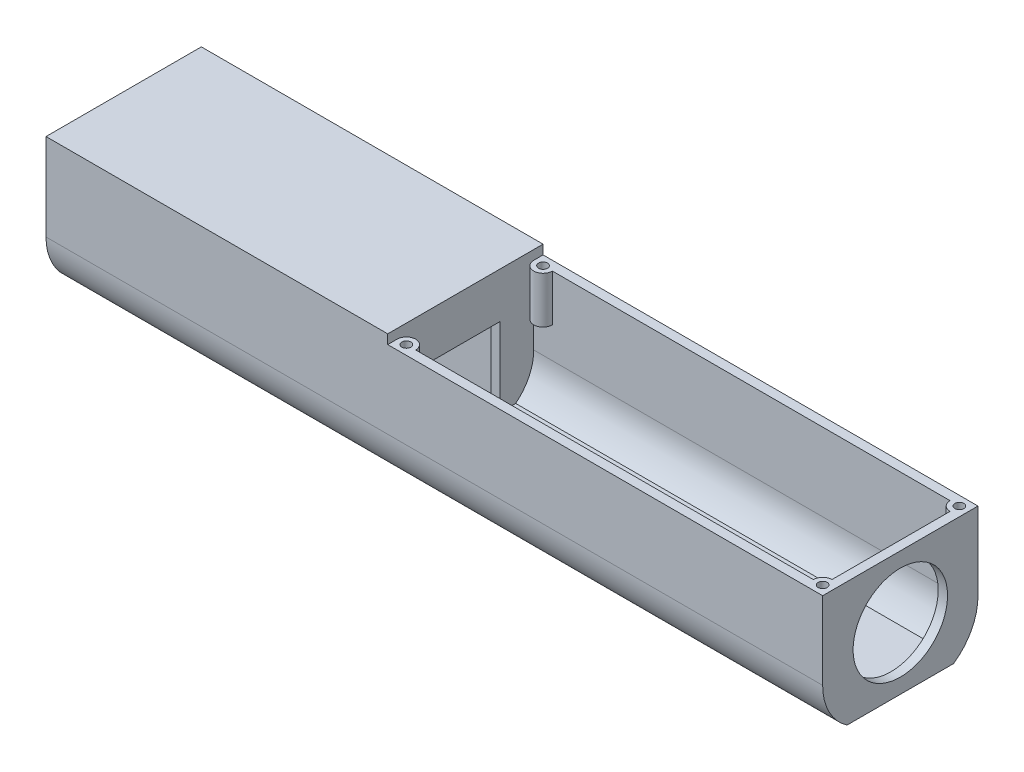
from build123d import *

# Parameters (mm, degrees)
SKETCH1_W           = 50
SKETCH1_H           = 25
BOSS_EXTRUDE1_DEPTH = 250
SHELL1_T            = -3
SKETCH2_W           = 50
SKETCH2_H           = 25
BOSS_EXTRUDE2_DEPTH = 110
SKETCH3_W           = 28.35
SKETCH3_H           = 31.35
CUT_EXTRUDE1_DEPTH  = 107
SKETCH4_W           = 28.35
SKETCH4_H           = 5
CUT_EXTRUDE2_DEPTH  = 3
SKETCH5_R           = 1.45
CUT_EXTRUDE3_DEPTH  = 10
SKETCH6_W           = 8
SKETCH6_H           = 2
CUT_EXTRUDE4_DEPTH  = 10
SKETCH7_W           = 22.35
SKETCH7_H           = 23.35
CUT_EXTRUDE5_DEPTH  = 10
SKETCH9_W           = 110
SKETCH9_H           = 50
BOSS_EXTRUDE3_DEPTH = 3
SKETCH10_R          = 15.2
CUT_EXTRUDE6_DEPTH  = 3
SKETCH11_R          = 3
BOSS_EXTRUDE4_DEPTH = 15
SKETCH12_R          = 1.45
CUT_EXTRUDE7_DEPTH  = 10
SKETCH13_R          = 1.6
CUT_EXTRUDE8_DEPTH  = 10
CHAMFER1_SIZE       = 1


with BuildPart() as part:
    # Sketch1 → Boss-Extrude1 (new body)
    with BuildSketch(Plane(origin=(0, 0, 0), x_dir=(0, 0, -1), z_dir=(1, 0, 0))):
        with BuildLine():
            ThreePointArc((23.062381853, -6.238185255), (20.988557625, -14.697361116), (15.237381853, -21.238185255))
            Line((15.237381853, -21.238185255), (-19.112618147, -21.238185255))
            ThreePointArc((-19.112618147, -21.238185255), (-24.86379392, -14.697361116), (-26.937618147, -6.238185255))
            Line((-26.937618147, -6.238185255), (23.062381853, -6.238185255))
        make_face()
        with Locations((-1.937618147, 6.261814745)):
            Rectangle(SKETCH1_W, SKETCH1_H)
    extrude(amount=BOSS_EXTRUDE1_DEPTH)

    # Shell1
    shell1_openings = [part.faces().sort_by_distance(p)[0] for p in [
        (125, 18.761814745, 1.937618147),
    ]]
    offset(amount=SHELL1_T, openings=shell1_openings, kind=Kind.INTERSECTION)

    # Sketch2 → Boss-Extrude2 (add)
    with BuildSketch(Plane.ZY):
        with Locations((1.937618147, 6.261814745)):
            Rectangle(SKETCH2_W, SKETCH2_H)
        with BuildLine():
            Line((-23.062381853, -6.238185255), (26.937618147, -6.238185255))
            ThreePointArc((26.937618147, -6.238185255), (24.86379392, -14.697361116), (19.112618147, -21.238185255))
            Line((19.112618147, -21.238185255), (-15.237381853, -21.238185255))
            ThreePointArc((-15.237381853, -21.238185255), (-20.988557625, -14.697361116), (-23.062381853, -6.238185255))
        make_face()
    extrude(amount=-BOSS_EXTRUDE2_DEPTH)

    # Sketch3 → Cut-Extrude1 (cut)
    with BuildSketch(Plane.ZY):
        with Locations((1.937618147, -5.563185255)):
            Rectangle(SKETCH3_W, SKETCH3_H)
    extrude(amount=-CUT_EXTRUDE1_DEPTH, mode=Mode.SUBTRACT)

    # Sketch4 → Cut-Extrude2 (cut)
    with BuildSketch(Plane.ZY):
        with Locations((1.937618147, 12.611814745)):
            Rectangle(SKETCH4_W, SKETCH4_H)
    extrude(amount=-CUT_EXTRUDE2_DEPTH, mode=Mode.SUBTRACT)

    # Sketch5 → Cut-Extrude3 (cut)
    with BuildSketch(Plane.ZY.offset(-3)):
        with Locations((-7.062381853, 12.611814745)):
            Circle(SKETCH5_R)
        with Locations((10.937618147, 12.611814745)):
            Circle(SKETCH5_R)
    extrude(amount=-CUT_EXTRUDE3_DEPTH, mode=Mode.SUBTRACT)

    # Sketch6 → Cut-Extrude4 (cut)
    with BuildSketch(Plane.ZY.offset(-107)):
        with Locations((1.937618147, -19.238185255)):
            Rectangle(SKETCH6_W, SKETCH6_H)
    extrude(amount=-CUT_EXTRUDE4_DEPTH, mode=Mode.SUBTRACT)

    # Sketch7 → Cut-Extrude5 (cut)
    with BuildSketch(Plane.ZY.offset(-107)):
        with Locations((1.937618147, -4.563185255)):
            Rectangle(SKETCH7_W, SKETCH7_H)
    extrude(amount=-CUT_EXTRUDE5_DEPTH, mode=Mode.SUBTRACT)

    # Sketch9 → Boss-Extrude3 (add)
    with BuildSketch(Plane(origin=(0, 18.761814745, 0), x_dir=(1, 0, 0), z_dir=(0, 1, 0))):
        with Locations((55, -1.937618147)):
            Rectangle(SKETCH9_W, SKETCH9_H)
    extrude(amount=BOSS_EXTRUDE3_DEPTH)

    # Sketch10 → Cut-Extrude6 (cut)
    with BuildSketch(Plane(origin=(250, 0, 0), x_dir=(0, 0, -1), z_dir=(1, 0, 0))):
        with Locations((-1.937618147, -1.238185255)):
            Circle(SKETCH10_R)
    extrude(amount=-CUT_EXTRUDE6_DEPTH, mode=Mode.SUBTRACT)

    # Sketch11 → Boss-Extrude4 (add)
    with BuildSketch(Plane(origin=(0, 18.761814745, 0), x_dir=(1, 0, 0), z_dir=(0, 1, 0))):
        with Locations((247, -23.937618147)):
            Circle(SKETCH11_R)
        with Locations((247, 20.062381853)):
            Circle(SKETCH11_R)
        with Locations((113, 20.062381853)):
            Circle(SKETCH11_R)
        with Locations((113, -23.937618147)):
            Circle(SKETCH11_R)
    extrude(amount=-BOSS_EXTRUDE4_DEPTH)

    # Sketch12 → Cut-Extrude7 (cut)
    with BuildSketch(Plane(origin=(0, 18.761814745, 0), x_dir=(1, 0, 0), z_dir=(0, 1, 0))):
        with Locations(Location((113, 20.062381853, 0), (0, 0, 270))):
            Circle(SKETCH12_R)
        with Locations(Location((113, -23.937618147, 0), (0, 0, 270))):
            Circle(SKETCH12_R)
        with Locations(Location((247, -23.937618147, 0), (0, 0, 270))):
            Circle(SKETCH12_R)
        with Locations(Location((247, 20.062381853, 0), (0, 0, 270))):
            Circle(SKETCH12_R)
    extrude(amount=-CUT_EXTRUDE7_DEPTH, mode=Mode.SUBTRACT)

    # Sketch13 → Cut-Extrude8 (cut)
    with BuildSketch(Plane(origin=(0, -18.238185255, 0), x_dir=(1, 0, 0), z_dir=(0, 1, 0))):
        with Locations(Location((150, 10.063881853, 0), (0, 0, 270))):
            Circle(SKETCH13_R)
        with Locations(Location((150, -13.939118147, 0), (0, 0, 270))):
            Circle(SKETCH13_R)
        with Locations(Location((196.482, -13.939118147, 0), (0, 0, 270))):
            Circle(SKETCH13_R)
        with Locations(Location((196.482, 10.063881853, 0), (0, 0, 270))):
            Circle(SKETCH13_R)
    extrude(amount=-CUT_EXTRUDE8_DEPTH, mode=Mode.SUBTRACT)

    # Chamfer1
    chamfer1_edges = [part.edges().sort_by_distance(p)[0] for p in [
        (196.482, -21.238185255, -11.663881853),
        (196.482, -21.238185255, 12.339118147),
        (150, -21.238185255, 12.339118147),
        (150, -21.238185255, -11.663881853),
    ]]
    chamfer(chamfer1_edges, length=CHAMFER1_SIZE)


solid = part.part
